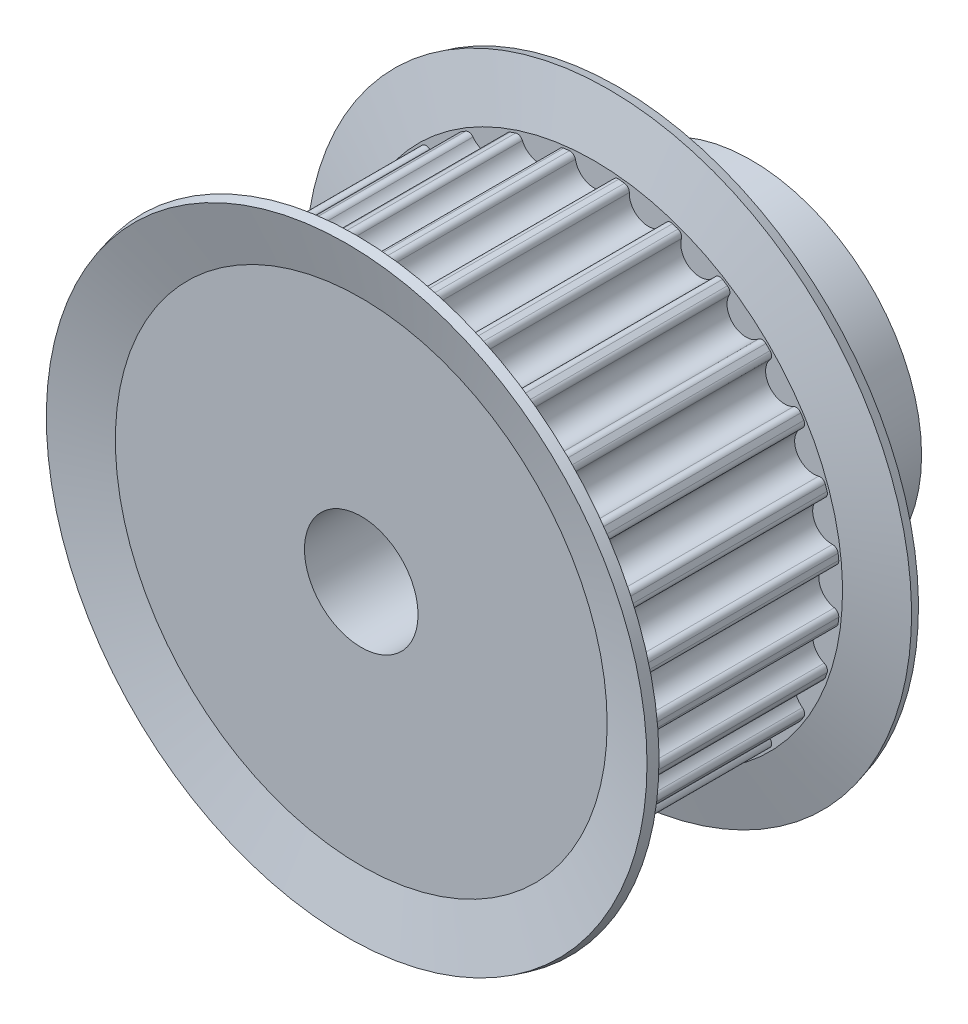
from build123d import *

# Parameters (mm, degrees)
KUGGLUCKA_DEPTH  = 12.8
CIRPATTERN_COUNT = 28
RITNING_4_R      = 3
AXELH_L_DEPTH    = 35.443940323


with BuildPart() as part:
    # Ritning 1 → Kugghjulsämne (revolve)
    with BuildSketch(Plane(origin=(0, 0, 0), x_dir=(0, 0, -1), z_dir=(1, 0, 0)), mode=Mode.PRIVATE) as kugghjuls_mne_sk:
        Polygon((6.4, 6.495), (6.4, 2.505), (14.2, 2.505), (14.2, -6.495), (6.4, -6.495), (-6.4, -6.495), (-6.4, 6.495), align=None)
    revolve(kugghjuls_mne_sk.sketch.rotate(Axis((0, -6.495, 6.4), (0, 0, -1)), 90), axis=Axis((0, -6.495, 6.4), (0, 0, -1)))

    # Ritning 2 → Kugglucka (cut)
    with BuildSketch(Plane.XY.offset(6.4)):
        with BuildLine():
            Line((1.302513782, 6.429533177), (1.302513782, 7.549533177))
            Line((1.302513782, 7.549533177), (-1.302513782, 7.549533177))
            Line((-1.302513782, 7.549533177), (-1.302513782, 6.429533177))
            ThreePointArc((-1.302513782, 6.429533177), (-1.099900528, 6.373277677), (-0.988661303, 6.194832596))
            ThreePointArc((-0.988661303, 6.194832596), (0, 5.375), (0.988661303, 6.194832596))
            ThreePointArc((0.988661303, 6.194832596), (1.099900528, 6.373277677), (1.302513782, 6.429533177))
        make_face()
    kugglucka = extrude(amount=-KUGGLUCKA_DEPTH, mode=Mode.SUBTRACT)

    # CirPattern: Kugglucka ×28 about axis
    cirpattern_axis = Axis((0, -6.495, 0), (0, 0, 1))
    for i in range(1, CIRPATTERN_COUNT):
        add(kugglucka.rotate(cirpattern_axis, i * 360 / CIRPATTERN_COUNT), mode=Mode.SUBTRACT)

    # Ritning 3 → Flänsar (revolve)
    with BuildSketch(Plane(origin=(0, 0, 0), x_dir=(0, 0, -1), z_dir=(1, 0, 0))):
        Polygon((-5.9, 4.7815), (-6.4, 4.7815), (-6.4, 6.495), (-7.170628684, 9.371025404), (-6.670628684, 9.505), (-5.9, 6.628974596), align=None)
        Polygon((5.9, 4.7815), (6.4, 4.7815), (6.4, 6.495), (7.170628684, 9.371025404), (6.670628684, 9.505), (5.9, 6.628974596), align=None)
    revolve(axis=Axis((0, -6.495, -6.4), (0, 0, 1)))

    # Ritning 4 → Axelhål (cut, through all)
    with BuildSketch(Plane.XY.offset(6.4)):
        with Locations((0, -6.495)):
            Circle(RITNING_4_R)
    extrude(amount=-AXELH_L_DEPTH, mode=Mode.SUBTRACT)


solid = part.part
